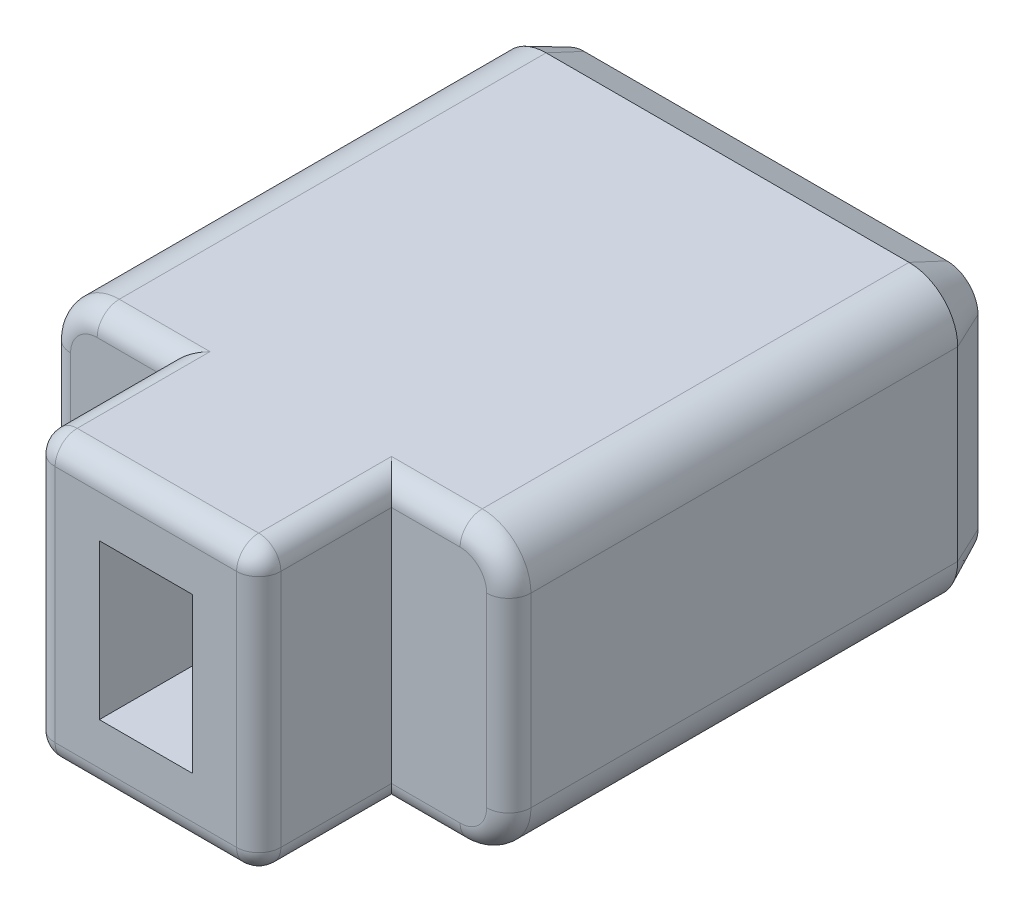
from build123d import *

# Parameters (mm, degrees)
BOSS_EXTRU_1_DEPTH      = 14
ESQUISSE3_W             = 2.1
ESQUISSE3_H             = 3.5
ENL_V_MAT_EXTRU_1_DEPTH = 3
ESQUISSE4_OUTSIDE_W     = 16.116
ESQUISSE4_OUTSIDE_H     = 12.116
ESQUISSE4_OUTSIDE_W_2   = 5.1
ESQUISSE4_OUTSIDE_H_2   = 6.4
ENL_V_MAT_EXTRU_2_DEPTH = 3
CONG_1_R                = 0.5
CHANFREIN1_SIZE         = 0.4
CHANFREIN1_SIZE2        = 0.857802768
ENL_V_MAT_EXTRU_3_DEPTH = 0.3
BOSS_EXTRU_2_DEPTH      = 0.3


with BuildPart() as part:
    # Esquisse2 → Boss.-Extru.1 (new body)
    with BuildSketch(Plane.XY):
        with BuildLine():
            Line((1.1, 0), (9.3, 0))
            ThreePointArc((9.3, 0), (10.077817459, 0.322182541), (10.4, 1.1))
            Line((10.4, 1.1), (10.4, 5.3))
            ThreePointArc((10.4, 5.3), (10.077817459, 6.077817459), (9.3, 6.4))
            Line((9.3, 6.4), (1.1, 6.4))
            ThreePointArc((1.1, 6.4), (0.322182541, 6.077817459), (0, 5.3))
            Line((0, 5.3), (0, 1.1))
            ThreePointArc((0, 1.1), (0.322182541, 0.322182541), (1.1, 0))
        make_face()
    extrude(amount=BOSS_EXTRU_1_DEPTH)

    # Esquisse3 → Enlèv. mat.-Extru.1 (cut)
    with BuildSketch(Plane.XY.offset(14)):
        with Locations((5.2, 3.2)):
            Rectangle(ESQUISSE3_W, ESQUISSE3_H)
    extrude(amount=-ENL_V_MAT_EXTRU_1_DEPTH, mode=Mode.SUBTRACT)

    # Esquisse4 outside → Enlèv. mat.-Extru.2 (cut)
    with BuildSketch(Plane.XY.offset(14)):
        with Locations((5.2, 3.2)):
            Rectangle(ESQUISSE4_OUTSIDE_W, ESQUISSE4_OUTSIDE_H)
        with Locations((5.2, 3.2)):
            Rectangle(ESQUISSE4_OUTSIDE_W_2, ESQUISSE4_OUTSIDE_H_2, mode=Mode.SUBTRACT)
    extrude(amount=-ENL_V_MAT_EXTRU_2_DEPTH, mode=Mode.SUBTRACT)

    # Congé1
    cong_1_edges = [part.edges().sort_by_distance(p)[0] for p in [
        (8.525, 0, 11),
        (10.077817459, 0.322182541, 11),
        (10.4, 3.2, 11),
        (10.077817459, 6.077817459, 11),
        (1.875, 6.4, 11),
        (0.322182541, 6.077817459, 11),
        (1.875, 0, 11),
        (0.322182541, 0.322182541, 11),
        (7.75, 6.4, 12.5),
        (2.65, 6.4, 12.5),
        (7.75, 0, 12.5),
        (2.65, 0, 12.5),
        (2.65, 3.2, 14),
        (5.2, 6.4, 14),
        (7.75, 3.2, 14),
        (5.2, 0, 14),
        (8.525, 6.4, 11),
        (0, 3.2, 11),
    ]]
    fillet(cong_1_edges, radius=CONG_1_R)

    # Chanfrein1
    chanfrein1_edges = [part.edges().sort_by_distance(p)[0] for p in [
        (5.2, 0, 0),
        (10.077817459, 0.322182541, 0),
        (0.322182541, 0.322182541, 0),
        (10.4, 3.2, 0),
        (0, 3.2, 0),
        (10.077817459, 6.077817459, 0),
        (0.322182541, 6.077817459, 0),
        (5.2, 6.4, 0),
    ]]
    chanfrein1_side = [part.faces().sort_by_distance(p)[0] for p in [
        (5.2, 3.2, 0),
    ]]
    chamfer(chanfrein1_edges, length=CHANFREIN1_SIZE, length2=CHANFREIN1_SIZE2, reference=chanfrein1_side[0])

    # Esquisse5 → Enlèv. mat.-Extru.3 (cut)
    with BuildSketch(Plane(origin=(0, 0, 0), x_dir=(-1, 0, 0), z_dir=(0, 0, -1))):
        with BuildLine():
            Line((-6.276923077, 1.3), (-6.276923077, 1.71025641))
            Line((-6.276923077, 1.71025641), (-5.082211538, 1.71025641))
            Line((-5.082211538, 1.71025641), (-4.892307692, 2.76875))
            add(Edge.make_bspline(
                [(-4.892307692, 2.76875), (-4.928720292, 2.75589485), (-4.998926765, 2.731109069), (-5.103384586, 2.704429713), (-5.202452531, 2.6885596), (-5.266722635, 2.685899738), (-5.29775641, 2.684615385)],
                knots=[0, 0, 0, 0, 1.113143318, 2.146231409, 3.104880253, 4, 4, 4, 4], degree=3))
            add(Edge.make_bspline(
                [(-5.29775641, 2.684615385), (-5.336299935, 2.68554409), (-5.411939336, 2.68736662), (-5.522173546, 2.706100802), (-5.627980502, 2.733508565), (-5.727810071, 2.775116846), (-5.823512365, 2.826278558), (-5.912783181, 2.890552636), (-5.997188953, 2.965581967), (-6.076381585, 3.050784094), (-6.1469281, 3.146137406), (-6.209879716, 3.247661883), (-6.262049523, 3.356392925), (-6.305730332, 3.470924468), (-6.338034489, 3.592734438), (-6.362205718, 3.720426219), (-6.376854914, 3.854680932), (-6.378597675, 3.94633088), (-6.379487179, 3.993108974)],
                knots=[0, 0, 0, 0, 0.973361819, 1.910165304, 2.819111759, 3.730587208, 4.636897028, 5.556735726, 6.503726233, 7.487915806, 8.491187352, 9.497430418, 10.502948427, 11.534954338, 12.591340586, 13.683767542, 14.817795931, 16, 16, 16, 16], degree=3))
            add(Edge.make_bspline(
                [(-6.379487179, 3.993108974), (-6.377396002, 4.057851586), (-6.373277648, 4.185355382), (-6.343370024, 4.372425727), (-6.292294817, 4.550710257), (-6.234205526, 4.692032529), (-6.178821606, 4.799052367), (-6.132833881, 4.874664501), (-6.083556369, 4.945768459), (-6.030349481, 5.011739172), (-5.974174284, 5.072807425), (-5.91468235, 5.129282045), (-5.85121832, 5.180781369), (-5.783879054, 5.226752576), (-5.714374172, 5.269189987), (-5.640899854, 5.303869168), (-5.565446494, 5.334909533), (-5.487076733, 5.359337493), (-5.406287724, 5.379000454), (-5.322909035, 5.392030445), (-5.236817258, 5.401707386), (-5.178394098, 5.402275518), (-5.148717949, 5.402564103)],
                knots=[0, 0, 0, 0, 1.85419403, 3.651641001, 5.409856766, 7.156045833, 8.018397344, 8.859477552, 9.689347527, 10.494696235, 11.285226259, 12.064570028, 12.842447769, 13.623442215, 14.39890816, 15.172257613, 15.947987714, 16.734397369, 17.521216312, 18.327473069, 19.150436932, 20, 20, 20, 20], degree=3))
            add(Edge.make_bspline(
                [(-5.148717949, 5.402564103), (-5.113667483, 5.401742682), (-5.044294606, 5.400116904), (-4.942922056, 5.38416141), (-4.845315537, 5.360282302), (-4.752075753, 5.32598562), (-4.663695346, 5.279972471), (-4.578043383, 5.227077646), (-4.498644162, 5.16142768), (-4.422583356, 5.088651374), (-4.353939814, 5.006582275), (-4.289420499, 4.920456466), (-4.235387766, 4.826209669), (-4.187027705, 4.727399895), (-4.147201231, 4.6220325), (-4.112989183, 4.511774766), (-4.088648221, 4.394921946), (-4.077479879, 4.315027532), (-4.071794872, 4.274358974)],
                knots=[0, 0, 0, 0, 0.980031455, 1.939706048, 2.864104874, 3.788654732, 4.711118148, 5.648267904, 6.599495805, 7.587812561, 8.589711592, 9.589713508, 10.594590454, 11.624065929, 12.664979174, 13.74300419, 14.851124159, 16, 16, 16, 16], degree=3))
            Line((-4.071794872, 4.274358974), (-4.430769231, 4.274358974))
            add(Edge.make_bspline(
                [(-4.430769231, 4.274358974), (-4.438023063, 4.312473073), (-4.451916917, 4.385476096), (-4.484032597, 4.487894408), (-4.520455587, 4.580133941), (-4.56760955, 4.660660993), (-4.620508348, 4.732956481), (-4.6825436, 4.796945505), (-4.752117007, 4.853818108), (-4.829012716, 4.902295117), (-4.910146488, 4.942535476), (-4.994870264, 4.971742138), (-5.082040021, 4.989033725), (-5.140897254, 4.99121571), (-5.170352564, 4.992307692)],
                knots=[0, 0, 0, 0, 1.237967357, 2.371179253, 3.422976385, 4.397391531, 5.342507057, 6.27756129, 7.235408665, 8.205595907, 9.17454497, 10.1213526, 11.05982427, 12, 12, 12, 12], degree=3))
            add(Edge.make_bspline(
                [(-5.170352564, 4.992307692), (-5.198989401, 4.991361498), (-5.25552166, 4.989493607), (-5.338796003, 4.975268277), (-5.418995243, 4.953132569), (-5.496161299, 4.921338401), (-5.570227491, 4.880369226), (-5.640505981, 4.829294002), (-5.708612888, 4.770547688), (-5.771726835, 4.702753351), (-5.830233393, 4.628888843), (-5.880776611, 4.548905089), (-5.924181533, 4.464800526), (-5.959675799, 4.376016122), (-5.986887097, 4.282875142), (-6.005817424, 4.185214632), (-6.018388853, 4.083178649), (-6.019795469, 4.013446763), (-6.020512821, 3.977884615)],
                knots=[0, 0, 0, 0, 0.933486303, 1.842804437, 2.747354045, 3.641866381, 4.558125182, 5.500831726, 6.470203692, 7.486945556, 8.516774202, 9.538911934, 10.567376691, 11.599339699, 12.652264323, 13.726765685, 14.840686828, 16, 16, 16, 16], degree=3))
            add(Edge.make_bspline(
                [(-6.020512821, 3.977884615), (-6.020105804, 3.945788306), (-6.019312796, 3.883253796), (-6.007031102, 3.791750266), (-5.990354728, 3.704635478), (-5.964707903, 3.622333435), (-5.934381496, 3.544053012), (-5.893756644, 3.471654038), (-5.848873669, 3.402398549), (-5.795468738, 3.339074136), (-5.736750533, 3.281845615), (-5.672959079, 3.231193279), (-5.603586791, 3.189905543), (-5.529955198, 3.154842154), (-5.45147742, 3.12777018), (-5.368245654, 3.108469951), (-5.280434955, 3.097258977), (-5.220331398, 3.095679719), (-5.189583333, 3.094871795)],
                knots=[0, 0, 0, 0, 1.127264374, 2.19629379, 3.240293685, 4.241187752, 5.222740122, 6.18483682, 7.153507664, 8.119992094, 9.08934518, 10.032192447, 10.975740628, 11.920689079, 12.894578236, 13.887514539, 14.919284615, 16, 16, 16, 16], degree=3))
            add(Edge.make_bspline(
                [(-5.189583333, 3.094871795), (-5.162848934, 3.095536279), (-5.107617846, 3.096909048), (-5.02301382, 3.106992053), (-4.934230539, 3.123278248), (-4.841423038, 3.145811632), (-4.744376138, 3.174795596), (-4.643191704, 3.210453666), (-4.537683528, 3.251703558), (-4.466957039, 3.283652866), (-4.430769231, 3.3)],
                knots=[0, 0, 0, 0, 0.810269167, 1.673950008, 2.579134618, 3.545268136, 4.567349434, 5.647883586, 6.7965197, 8, 8, 8, 8], degree=3))
            Line((-4.430769231, 3.3), (-4.78974359, 1.3))
            Line((-4.78974359, 1.3), (-6.276923077, 1.3))
        make_face()
    extrude(amount=-ENL_V_MAT_EXTRU_3_DEPTH, mode=Mode.SUBTRACT)


with BuildPart() as body_2:
    # Esquisse5<2> → Boss.-Extru.2 (new body)
    with BuildSketch(Plane(origin=(0, 0, 0), x_dir=(-1, 0, 0), z_dir=(0, 0, -1))):
        with BuildLine():
            Line((-6.276923077, 1.3), (-6.276923077, 1.71025641))
            Line((-6.276923077, 1.71025641), (-5.082211538, 1.71025641))
            Line((-5.082211538, 1.71025641), (-4.892307692, 2.76875))
            add(Edge.make_bspline(
                [(-4.892307692, 2.76875), (-4.928720292, 2.75589485), (-4.998926765, 2.731109069), (-5.103384586, 2.704429713), (-5.202452531, 2.6885596), (-5.266722635, 2.685899738), (-5.29775641, 2.684615385)],
                knots=[0, 0, 0, 0, 1.113143318, 2.146231409, 3.104880253, 4, 4, 4, 4], degree=3))
            add(Edge.make_bspline(
                [(-5.29775641, 2.684615385), (-5.336299935, 2.68554409), (-5.411939336, 2.68736662), (-5.522173546, 2.706100802), (-5.627980502, 2.733508565), (-5.727810071, 2.775116846), (-5.823512365, 2.826278558), (-5.912783181, 2.890552636), (-5.997188953, 2.965581967), (-6.076381585, 3.050784094), (-6.1469281, 3.146137406), (-6.209879716, 3.247661883), (-6.262049523, 3.356392925), (-6.305730332, 3.470924468), (-6.338034489, 3.592734438), (-6.362205718, 3.720426219), (-6.376854914, 3.854680932), (-6.378597675, 3.94633088), (-6.379487179, 3.993108974)],
                knots=[0, 0, 0, 0, 0.973361819, 1.910165304, 2.819111759, 3.730587208, 4.636897028, 5.556735726, 6.503726233, 7.487915806, 8.491187352, 9.497430418, 10.502948427, 11.534954338, 12.591340586, 13.683767542, 14.817795931, 16, 16, 16, 16], degree=3))
            add(Edge.make_bspline(
                [(-6.379487179, 3.993108974), (-6.377396002, 4.057851586), (-6.373277648, 4.185355382), (-6.343370024, 4.372425727), (-6.292294817, 4.550710257), (-6.234205526, 4.692032529), (-6.178821606, 4.799052367), (-6.132833881, 4.874664501), (-6.083556369, 4.945768459), (-6.030349481, 5.011739172), (-5.974174284, 5.072807425), (-5.91468235, 5.129282045), (-5.85121832, 5.180781369), (-5.783879054, 5.226752576), (-5.714374172, 5.269189987), (-5.640899854, 5.303869168), (-5.565446494, 5.334909533), (-5.487076733, 5.359337493), (-5.406287724, 5.379000454), (-5.322909035, 5.392030445), (-5.236817258, 5.401707386), (-5.178394098, 5.402275518), (-5.148717949, 5.402564103)],
                knots=[0, 0, 0, 0, 1.85419403, 3.651641001, 5.409856766, 7.156045833, 8.018397344, 8.859477552, 9.689347527, 10.494696235, 11.285226259, 12.064570028, 12.842447769, 13.623442215, 14.39890816, 15.172257613, 15.947987714, 16.734397369, 17.521216312, 18.327473069, 19.150436932, 20, 20, 20, 20], degree=3))
            add(Edge.make_bspline(
                [(-5.148717949, 5.402564103), (-5.113667483, 5.401742682), (-5.044294606, 5.400116904), (-4.942922056, 5.38416141), (-4.845315537, 5.360282302), (-4.752075753, 5.32598562), (-4.663695346, 5.279972471), (-4.578043383, 5.227077646), (-4.498644162, 5.16142768), (-4.422583356, 5.088651374), (-4.353939814, 5.006582275), (-4.289420499, 4.920456466), (-4.235387766, 4.826209669), (-4.187027705, 4.727399895), (-4.147201231, 4.6220325), (-4.112989183, 4.511774766), (-4.088648221, 4.394921946), (-4.077479879, 4.315027532), (-4.071794872, 4.274358974)],
                knots=[0, 0, 0, 0, 0.980031455, 1.939706048, 2.864104874, 3.788654732, 4.711118148, 5.648267904, 6.599495805, 7.587812561, 8.589711592, 9.589713508, 10.594590454, 11.624065929, 12.664979174, 13.74300419, 14.851124159, 16, 16, 16, 16], degree=3))
            Line((-4.071794872, 4.274358974), (-4.430769231, 4.274358974))
            add(Edge.make_bspline(
                [(-4.430769231, 4.274358974), (-4.438023063, 4.312473073), (-4.451916917, 4.385476096), (-4.484032597, 4.487894408), (-4.520455587, 4.580133941), (-4.56760955, 4.660660993), (-4.620508348, 4.732956481), (-4.6825436, 4.796945505), (-4.752117007, 4.853818108), (-4.829012716, 4.902295117), (-4.910146488, 4.942535476), (-4.994870264, 4.971742138), (-5.082040021, 4.989033725), (-5.140897254, 4.99121571), (-5.170352564, 4.992307692)],
                knots=[0, 0, 0, 0, 1.237967357, 2.371179253, 3.422976385, 4.397391531, 5.342507057, 6.27756129, 7.235408665, 8.205595907, 9.17454497, 10.1213526, 11.05982427, 12, 12, 12, 12], degree=3))
            add(Edge.make_bspline(
                [(-5.170352564, 4.992307692), (-5.198989401, 4.991361498), (-5.25552166, 4.989493607), (-5.338796003, 4.975268277), (-5.418995243, 4.953132569), (-5.496161299, 4.921338401), (-5.570227491, 4.880369226), (-5.640505981, 4.829294002), (-5.708612888, 4.770547688), (-5.771726835, 4.702753351), (-5.830233393, 4.628888843), (-5.880776611, 4.548905089), (-5.924181533, 4.464800526), (-5.959675799, 4.376016122), (-5.986887097, 4.282875142), (-6.005817424, 4.185214632), (-6.018388853, 4.083178649), (-6.019795469, 4.013446763), (-6.020512821, 3.977884615)],
                knots=[0, 0, 0, 0, 0.933486303, 1.842804437, 2.747354045, 3.641866381, 4.558125182, 5.500831726, 6.470203692, 7.486945556, 8.516774202, 9.538911934, 10.567376691, 11.599339699, 12.652264323, 13.726765685, 14.840686828, 16, 16, 16, 16], degree=3))
            add(Edge.make_bspline(
                [(-6.020512821, 3.977884615), (-6.020105804, 3.945788306), (-6.019312796, 3.883253796), (-6.007031102, 3.791750266), (-5.990354728, 3.704635478), (-5.964707903, 3.622333435), (-5.934381496, 3.544053012), (-5.893756644, 3.471654038), (-5.848873669, 3.402398549), (-5.795468738, 3.339074136), (-5.736750533, 3.281845615), (-5.672959079, 3.231193279), (-5.603586791, 3.189905543), (-5.529955198, 3.154842154), (-5.45147742, 3.12777018), (-5.368245654, 3.108469951), (-5.280434955, 3.097258977), (-5.220331398, 3.095679719), (-5.189583333, 3.094871795)],
                knots=[0, 0, 0, 0, 1.127264374, 2.19629379, 3.240293685, 4.241187752, 5.222740122, 6.18483682, 7.153507664, 8.119992094, 9.08934518, 10.032192447, 10.975740628, 11.920689079, 12.894578236, 13.887514539, 14.919284615, 16, 16, 16, 16], degree=3))
            add(Edge.make_bspline(
                [(-5.189583333, 3.094871795), (-5.162848934, 3.095536279), (-5.107617846, 3.096909048), (-5.02301382, 3.106992053), (-4.934230539, 3.123278248), (-4.841423038, 3.145811632), (-4.744376138, 3.174795596), (-4.643191704, 3.210453666), (-4.537683528, 3.251703558), (-4.466957039, 3.283652866), (-4.430769231, 3.3)],
                knots=[0, 0, 0, 0, 0.810269167, 1.673950008, 2.579134618, 3.545268136, 4.567349434, 5.647883586, 6.7965197, 8, 8, 8, 8], degree=3))
            Line((-4.430769231, 3.3), (-4.78974359, 1.3))
            Line((-4.78974359, 1.3), (-6.276923077, 1.3))
        make_face()
    extrude(amount=BOSS_EXTRU_2_DEPTH)


solid = Compound([part.part, body_2.part])
